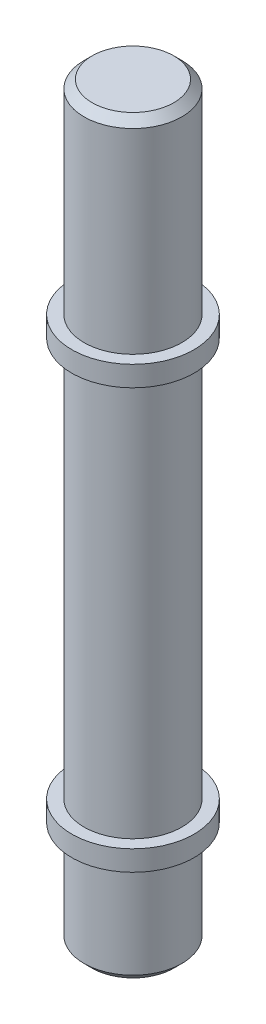
from build123d import *

# Parameters (mm, degrees)
CHAMFER1_SIZE = 2


with BuildPart() as part:
    # Sketch1 → Revolve1 (revolve)
    with BuildSketch(Plane.XY, mode=Mode.PRIVATE) as revolve1_sk:
        Polygon((0, -88.300541079), (12, -88.300541079), (12, -62.300541079), (15, -62.300541079), (15, -57.300541079), (12, -57.300541079), (12, 40.699458921), (15, 40.699458921), (15, 45.699458921), (12, 45.699458921), (12, 95.699458921), (0, 95.699458921), align=None)
    revolve(revolve1_sk.sketch.rotate(Axis((0, 95.699458921, 0), (0, -1, 0)), 180), axis=Axis((0, 95.699458921, 0), (0, -1, 0)))

    # Chamfer1
    chamfer1_edges = [part.edges().sort_by_distance(p)[0] for p in [
        (12, -88.300541079, 0),
        (12, 95.699458921, 0),
    ]]
    chamfer(chamfer1_edges, length=CHAMFER1_SIZE)


solid = part.part
